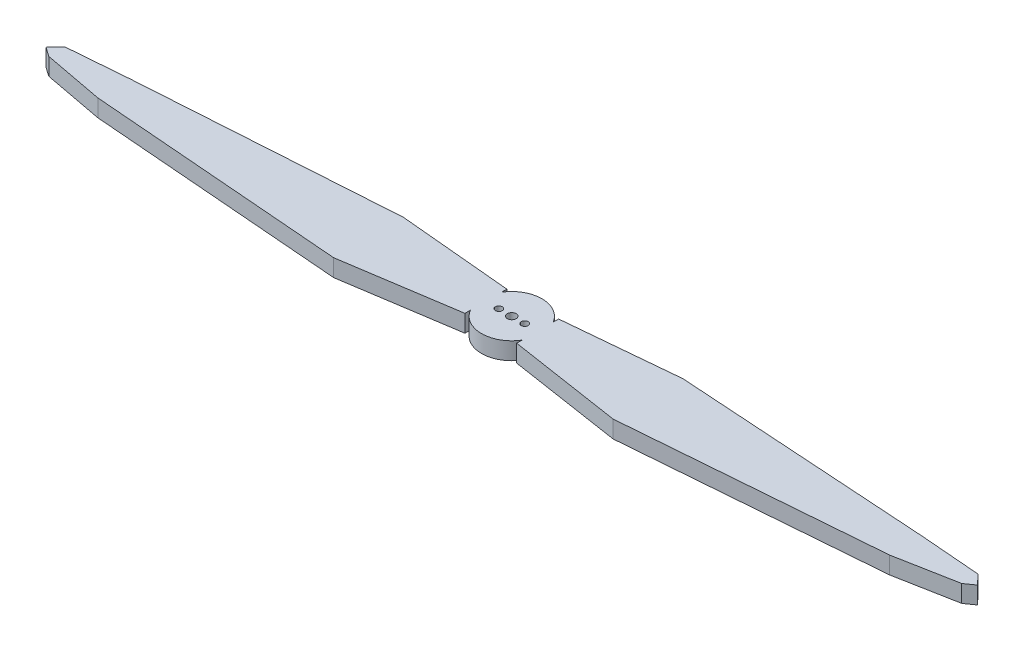
from build123d import *

# Parameters (mm, degrees)
BOSS_EXTRUDE1_DEPTH     = 8
BOSS_EXTRUDE1_2_DEPTH   = 8
SKETCH2_R               = 14
BOSS_EXTRUDE2_DEPTH     = 8
CUT_EXTRUDE1_DEPTH      = 217.781153328
CUT_EXTRUDE1_DEPTH_BACK = 217.781153328
SKETCH3_R               = 2.05
SKETCH3_R_2             = 1.6


with BuildPart() as part:
    # Sketch1 → Boss-Extrude1 (new body)
    with BuildSketch(Plane(origin=(0, 0, 0), x_dir=(1, 0, 0), z_dir=(0, 1, 0))):
        Polygon((12, -9.7155), (64.77, -17.81175), (183.515, -8.31215), (211.582, -3.0226), (215.9, 0), (211.582, 4.5339), (183.515, 6.80085), (64.77, 14.57325), (12, 9.7155), align=None)
    extrude(amount=BOSS_EXTRUDE1_DEPTH)



with BuildPart() as body_2:
    # Sketch1 → Boss-Extrude1 2 (new body)
    with BuildSketch(Plane(origin=(0, 0, 0), x_dir=(1, 0, 0), z_dir=(0, 1, 0))):
        Polygon((-12, -9.7155), (-64.77, -17.81175), (-183.515, -8.31215), (-211.582, -3.0226), (-215.9, 0), (-211.582, 4.5339), (-183.515, 6.80085), (-64.77, 14.57325), (-12, 9.7155), align=None)
    extrude(amount=BOSS_EXTRUDE1_2_DEPTH)


with BuildPart() as part_1:
    add(part.part)

    add(body_2.part)  # Boss-Extrude2 merges body 2
    # Sketch2 → Boss-Extrude2 (add)
    with BuildSketch(Plane(origin=(0, 0, 0), x_dir=(1, 0, 0), z_dir=(0, 1, 0))):
        Circle(SKETCH2_R)
    extrude(amount=BOSS_EXTRUDE2_DEPTH)

    # Sketch3 → Cut-Extrude1 (cut, two sides: drawn at the far end of the back side and taken through both)
    with BuildSketch(Plane(origin=(0, 0, 0), x_dir=(1, 0, 0), z_dir=(0, 1, 0)).offset(-CUT_EXTRUDE1_DEPTH_BACK)):
        with Locations(Location((0, 0, 0), (0, 0, 270))):
            Circle(SKETCH3_R)
        with Locations(Location((6, 0, 0), (0, 0, 270))):
            Circle(SKETCH3_R_2)
        with Locations(Location((-6, 0, 0), (0, 0, 270))):
            Circle(SKETCH3_R_2)
    extrude(amount=CUT_EXTRUDE1_DEPTH + CUT_EXTRUDE1_DEPTH_BACK, mode=Mode.SUBTRACT)


solid = part_1.part
